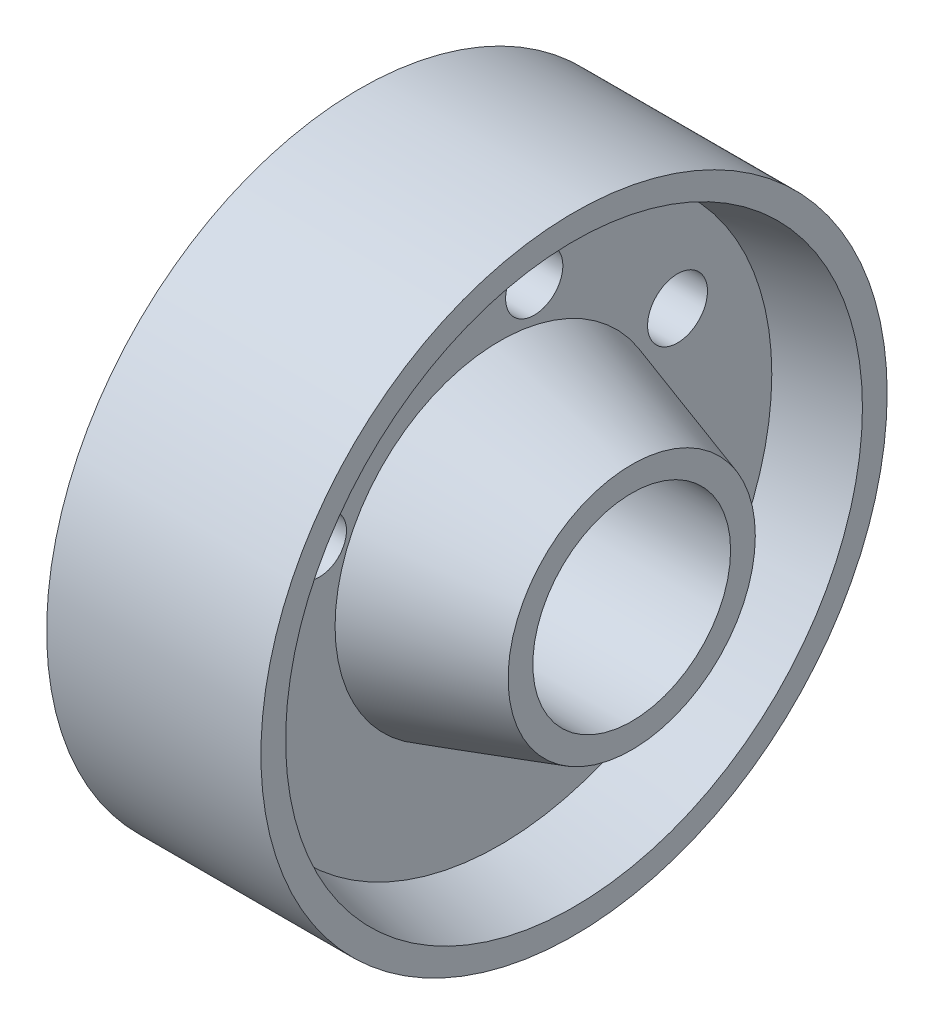
from build123d import *

# Parameters (mm, degrees)
CUT_EXTRUDE1_DEPTH      = 59.855755878
CUT_EXTRUDE1_DEPTH_BACK = 59.855755878
SKETCH2_R               = 3.253242351
SKETCH2_R_2             = 3.475880092
SKETCH2_R_3             = 3.633937036


with BuildPart() as part:
    # Sketch1 → Revolve2 (revolve)
    with BuildSketch(Plane.XY, mode=Mode.PRIVATE) as revolve2_sk:
        Polygon((20, 12), (20, 15), (4, 20), (4, 33), (13, 35), (13, 38), (-13, 38), (-13, 35), (-4, 33), (-4, 20), (-20, 15), (-20, 12), align=None)
    revolve(revolve2_sk.sketch.rotate(Axis((29.536406987, 0, 0), (-1, 0, 0)), 90), axis=Axis((29.536406987, 0, 0), (-1, 0, 0)))

    # Sketch2 → Cut-Extrude1 (cut, two sides: drawn at the far end of the back side and taken through both)
    with BuildSketch(Plane(origin=(4, 0, 0), x_dir=(0, 0, -1), z_dir=(1, 0, 0)).offset(-CUT_EXTRUDE1_DEPTH_BACK)):
        with Locations((-21.868025182, 9.381578111)):
            Circle(SKETCH2_R)
        with Locations((4.169252075, 24.089721188)):
            Circle(SKETCH2_R_2)
        with Locations((21.558463792, 12.634820462)):
            Circle(SKETCH2_R_3)
    extrude(amount=CUT_EXTRUDE1_DEPTH + CUT_EXTRUDE1_DEPTH_BACK, mode=Mode.SUBTRACT)


solid = part.part
